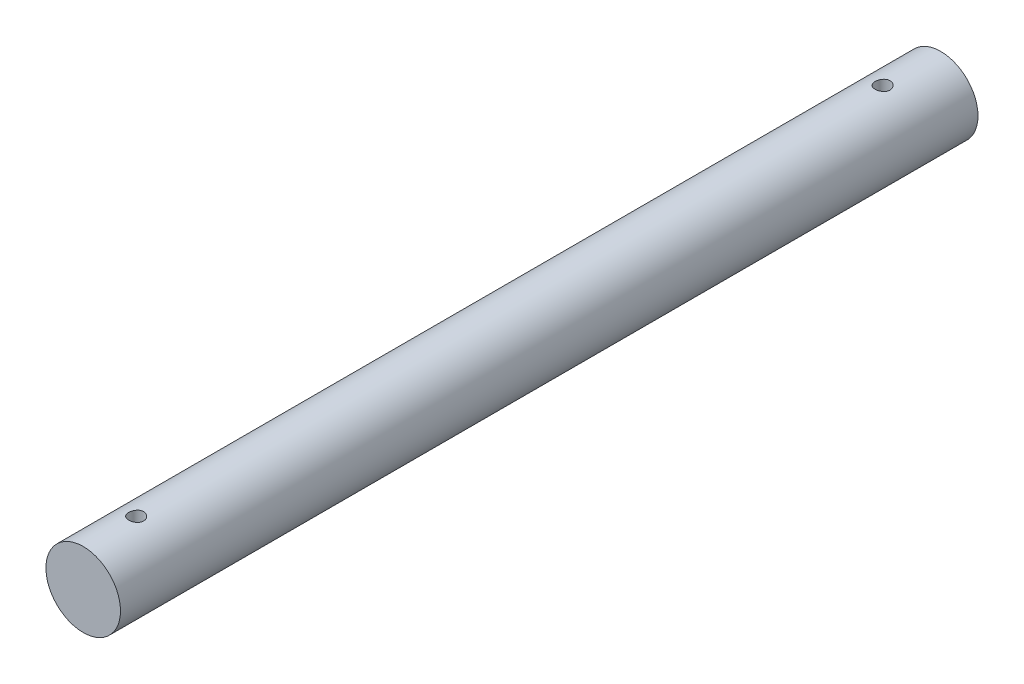
from build123d import *

# Parameters (mm, degrees)
SKETCH_1_R          = 5
EXTRUDE_1_DEPTH     = 115
SKETCH_2_R          = 1
CUT_EXTRUDE_1_DEPTH = 10
SKETCH_4_R          = 1
CUT_EXTRUDE_2_DEPTH = 10


with BuildPart() as part:
    # Эскиз1 → Вытянуть1 (new body)
    with BuildSketch(Plane.XY):
        Circle(SKETCH_1_R)
    extrude(amount=EXTRUDE_1_DEPTH)

    # Эскиз2 → Вырез-Вытянуть1 (cut, symmetric)
    with BuildSketch(Plane(origin=(0, 0, 0), x_dir=(1, 0, 0), z_dir=(0, 1, 0))):
        with Locations(Location((0, -7.801268192, 0), (0, 0, 270))):
            Circle(SKETCH_2_R)
    extrude(amount=CUT_EXTRUDE_1_DEPTH, both=True, mode=Mode.SUBTRACT)

    # Эскиз4 → Вырез-Вытянуть2 (cut, symmetric)
    with BuildSketch(Plane(origin=(0, 0, 0), x_dir=(1, 0, 0), z_dir=(0, 1, 0))):
        with Locations(Location((0, -107.898465976, 0), (0, 0, 270))):
            Circle(SKETCH_4_R)
    extrude(amount=CUT_EXTRUDE_2_DEPTH, both=True, mode=Mode.SUBTRACT)


solid = part.part
